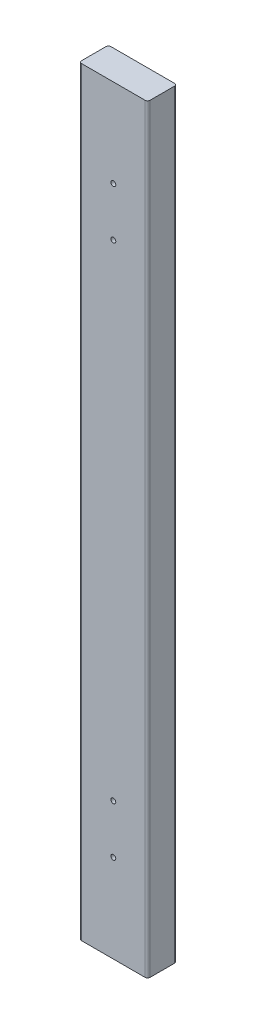
from build123d import *

# Parameters (mm, degrees)
SKETCH1_W                   = 88.9
SKETCH1_H                   = 38.1
BOSS_EXTRUDE1_DEPTH         = 985.8375
FILLET1_R                   = 3.175
F_1_4_0_25_DIAMETER_HOLE1_D = 6.35


with BuildPart() as part:
    # Sketch1 → Boss-Extrude1 (new body)
    with BuildSketch(Plane(origin=(0, 0, 0), x_dir=(1, 0, 0), z_dir=(0, 1, 0))):
        Rectangle(SKETCH1_W, SKETCH1_H)
    extrude(amount=BOSS_EXTRUDE1_DEPTH)

    # Fillet1
    fillet1_edges = [part.edges().sort_by_distance(p)[0] for p in [
        (-44.45, 492.91875, -19.05),
        (44.45, 492.91875, -19.05),
        (44.45, 492.91875, 19.05),
        (-44.45, 492.91875, 19.05),
    ]]
    fillet(fillet1_edges, radius=FILLET1_R)

    # 1/4 (0.25) Diameter Hole1 (through all)
    with Locations(Plane.XY.offset(19.05)):
        with Locations((0, 114.3), (0, 177.8), (0, 808.0375), (0, 871.5375)):
            Hole(F_1_4_0_25_DIAMETER_HOLE1_D / 2)


solid = part.part
